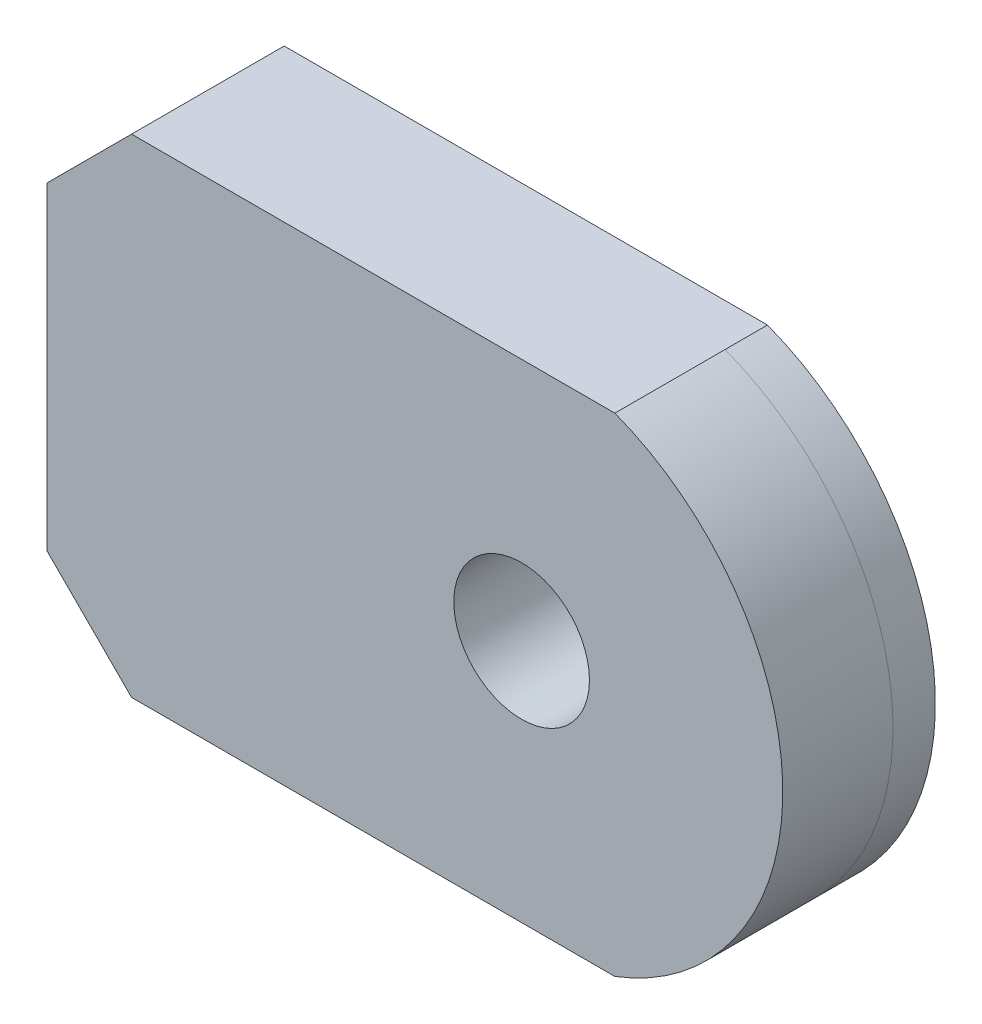
from build123d import *

# Parameters (mm, degrees)
ESQUISSE1_R             = 1.98
ESQUISSE1_R_2           = 6.3
ESQUISSE1_R_3           = 1.475
ESQUISSE1_R_4           = 1.05
ESQUISSE1_R_5           = 0.85
BOSS_EXTRU_2_DEPTH      = 2.5
BOSS_EXTRU_3_DEPTH      = 6.5
ESQUISSE3_R             = 4
ENL_V_MAT_EXTRU_1_DEPTH = 10


with BuildPart() as part:
    # Esquisse1 → Boss.-Extru.2 (new body)
    with BuildSketch(Plane.XY):
        with BuildLine():
            Line((22.5, 28.77), (5, 28.77))
            Line((5, 28.77), (0, 23.77))
            Line((0, 23.77), (0, 5))
            Line((0, 5), (5, 0))
            Line((5, 0), (22.5, 0))
            Line((22.5, 0), (33.5, 0))
            ThreePointArc((33.5, 0), (43.400591709, 14.385), (33.5, 28.77))
            Line((33.5, 28.77), (22.5, 28.77))
        make_face()
        with Locations((12.25, 3.905)):
            Circle(ESQUISSE1_R, mode=Mode.SUBTRACT)
        with Locations((12.25, 24.865)):
            Circle(ESQUISSE1_R, mode=Mode.SUBTRACT)
        with Locations((28, 14.385)):
            Circle(ESQUISSE1_R_2, mode=Mode.SUBTRACT)
        with Locations((28, 4.86)):
            Circle(ESQUISSE1_R_3, mode=Mode.SUBTRACT)
        with Locations((28, 23.91)):
            Circle(ESQUISSE1_R_3, mode=Mode.SUBTRACT)
        with Locations((36.980256121, 5.404743879)):
            Circle(ESQUISSE1_R_4, mode=Mode.SUBTRACT)
        with Locations((36.980256121, 23.365256121)):
            Circle(ESQUISSE1_R_4, mode=Mode.SUBTRACT)
        with Locations((19.019743879, 23.365256121)):
            Circle(ESQUISSE1_R_4, mode=Mode.SUBTRACT)
        with Locations((19.019743879, 5.404743879)):
            Circle(ESQUISSE1_R_4, mode=Mode.SUBTRACT)
        with Locations((24, 21.31320323)):
            Circle(ESQUISSE1_R_5, mode=Mode.SUBTRACT)
        with Locations((32, 7.45679677)):
            Circle(ESQUISSE1_R_5, mode=Mode.SUBTRACT)
    extrude(amount=BOSS_EXTRU_2_DEPTH)

    # Esquisse2 → Boss.-Extru.3 (add)
    with BuildSketch(Plane.XY.offset(2.5)):
        with BuildLine():
            Line((5, 28.77), (33.5, 28.77))
            ThreePointArc((33.5, 28.77), (43.400493129, 14.385), (33.5, 0))
            Line((33.5, 0), (5, 0))
            Line((5, 0), (0, 5))
            Line((0, 5), (0, 23.77))
            Line((0, 23.77), (5, 28.77))
        make_face()
    extrude(amount=BOSS_EXTRU_3_DEPTH)

    # Esquisse3 → Enlèv. mat.-Extru.1 (cut)
    with BuildSketch(Plane.XY.offset(9)):
        with Locations((27.999846655, 14.385)):
            Circle(ESQUISSE3_R)
    extrude(amount=-ENL_V_MAT_EXTRU_1_DEPTH, mode=Mode.SUBTRACT)


solid = part.part
